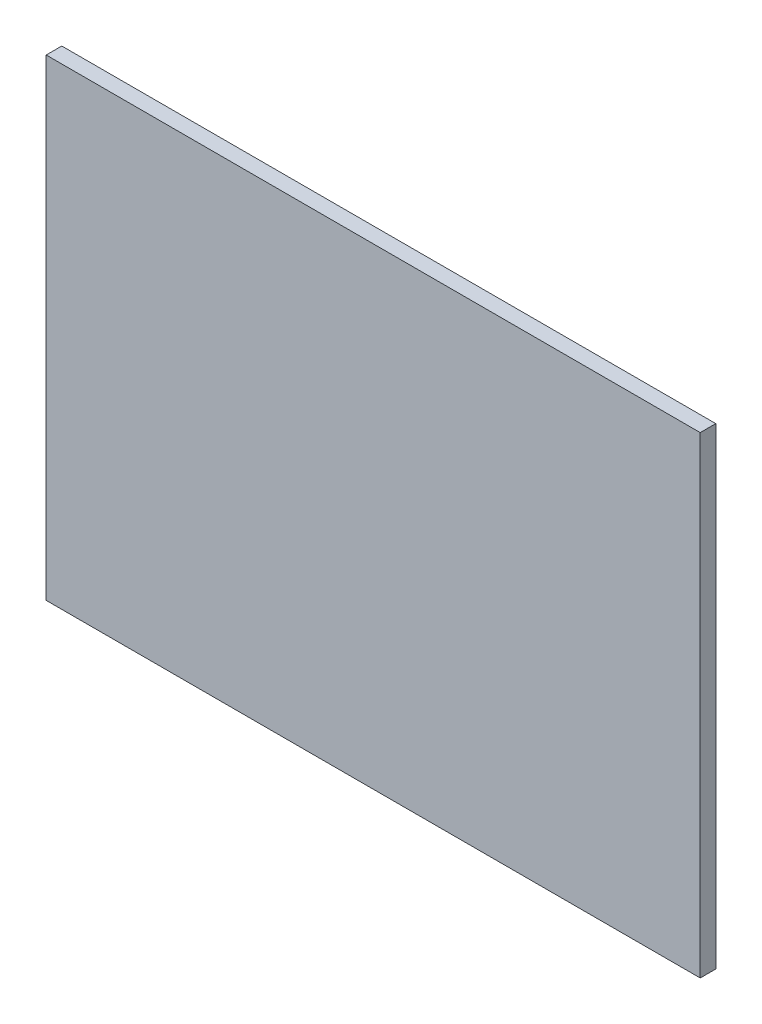
from build123d import *

# Parameters (mm, degrees)
SKETCH_1_W      = 126
SKETCH_1_H      = 91
EXTRUDE_1_DEPTH = 3


with BuildPart() as part:
    # 草图1 → 凸台-拉伸1 (new body)
    with BuildSketch(Plane.XY):
        Rectangle(SKETCH_1_W, SKETCH_1_H)
    extrude(amount=EXTRUDE_1_DEPTH)


solid = part.part
